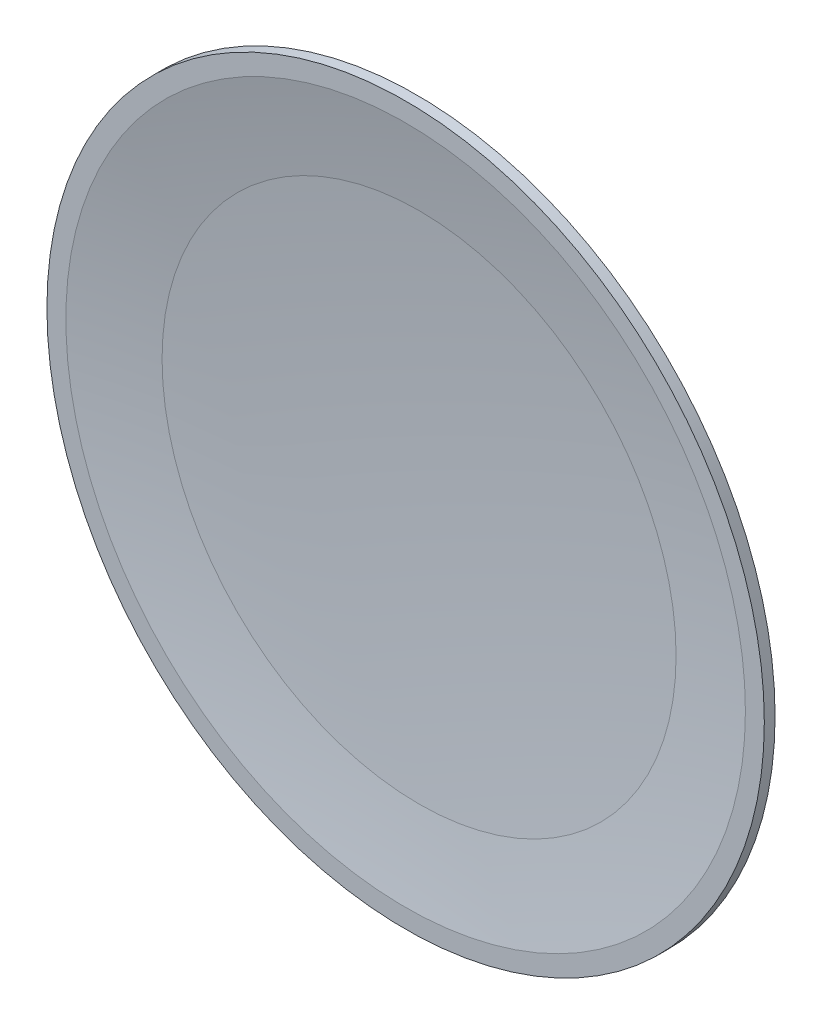
from build123d import *


with BuildPart() as part:
    # 草图1 → 旋转5 (revolve)
    with BuildSketch(Plane(origin=(0, 0, 0), x_dir=(1, 0, 0), z_dir=(0, 1, 0))):
        with BuildLine():
            Line((4.75, 37.642530217), (5, 37.642530217))
            Line((5, 37.642530217), (5, 37.492530217))
            Line((5, 37.492530217), (4.736204208, 37.492530217))
            ThreePointArc((4.736204208, 37.492530217), (4.160424845, 37.592803525), (3.58253169, 37.680073868))
            ThreePointArc((3.58253169, 37.680073868), (1.793279691, 37.8074946), (0, 37.85))
            Line((0, 37.85), (0, 38))
            ThreePointArc((0, 38), (1.802027362, 37.957248285), (3.6, 37.829089336))
            ThreePointArc((3.6, 37.829089336), (4.176041915, 37.742232418), (4.75, 37.642530217))
        make_face()
    revolve(axis=Axis((0, 0, -22.128426055), (0, 0, 1)))


solid = part.part
